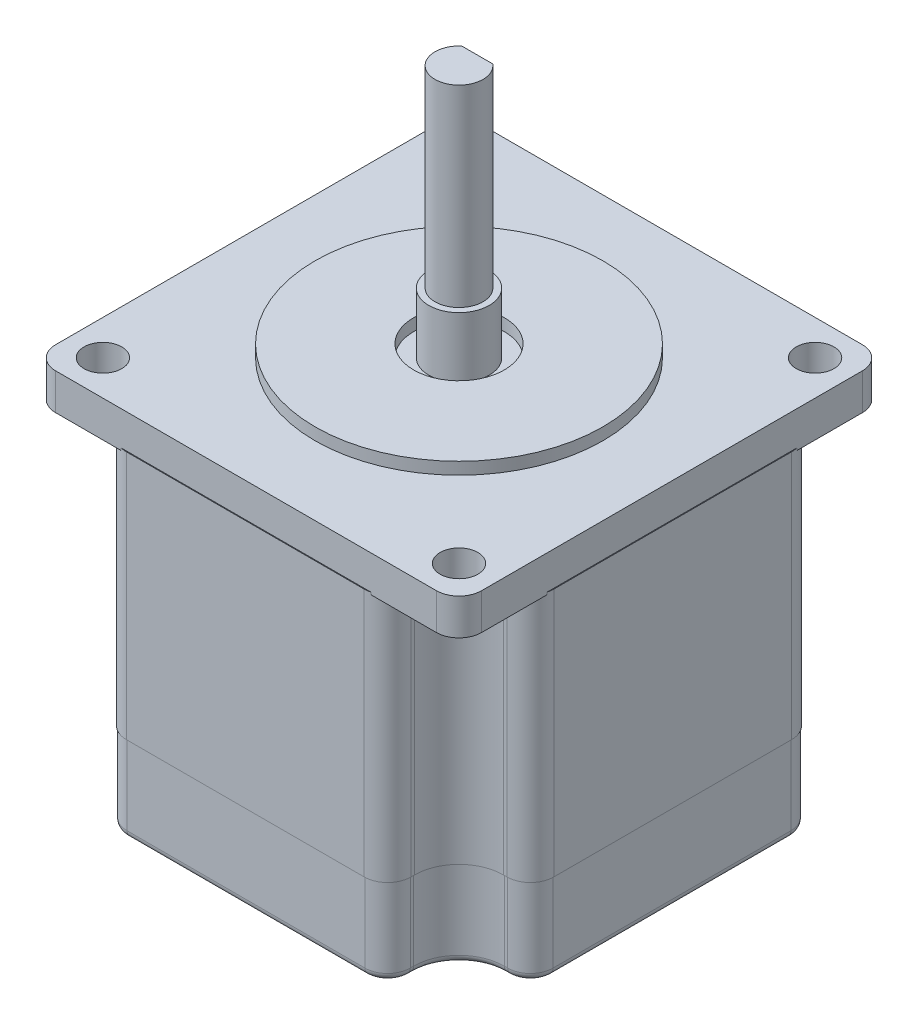
from build123d import *

# Parameters (mm, degrees)
SKETCH1_W                = 56.4
SKETCH1_H                = 56.4
BOSS_EXTRUDE1_DEPTH      = 24.5
CUT_EXTRUDE1_START       = 4.8
CUT_EXTRUDE1_DEPTH       = 59.378160784
FILLET1_R                = 3
FILLET2_R                = 1
SKETCH3_R                = 2.5
CUT_EXTRUDE2_DEPTH       = 55.8
SKETCH4_R                = 19.05
BOSS_EXTRUDE2_DEPTH      = 1.6
SKETCH5_R                = 3.175
BOSS_EXTRUDE3_DEPTH      = 33.5
CUT_EXTRUDE3_START       = -15
CUT_EXTRUDE3_DEPTH       = 15
CUT_EXTRUDE4_DEPTH       = 71.388067171
CUT_EXTRUDE4_DEPTH_BACK  = 71.388067171
FILLET3_R                = 5
CUT_EXTRUDE5_START       = -1.6
SKETCH8_R                = 6
SKETCH8_R_2              = 3.175
CUT_EXTRUDE5_DEPTH       = 1.6
BOSS_EXTRUDE4_START      = -11.5
BOSS_EXTRUDE4_DEPTH      = 33
BOSS_EXTRUDE5_DEPTH      = 6.4
BOSS_EXTRUDE5_DEPTH_BACK = 50.6
SKETCH11_R               = 4
BOSS_EXTRUDE6_START      = -1
SKETCH12_W               = 20.6
SKETCH12_H               = 11.5
BOSS_EXTRUDE6_DEPTH      = 6.4


with BuildPart() as part:
    # Sketch1 → Boss-Extrude1 (new, symmetric)
    with BuildSketch(Plane(origin=(0, 0, 0), x_dir=(1, 0, 0), z_dir=(0, 1, 0))):
        Rectangle(SKETCH1_W, SKETCH1_H)
    extrude(amount=BOSS_EXTRUDE1_DEPTH, both=True)

    # Sketch2 → Cut-Extrude1 (cut, through all)
    with BuildSketch(Plane.XZ.offset(-24.5).offset(CUT_EXTRUDE1_START)):
        with BuildLine():
            Line((-18.75, 28.2), (-18.75, 24.75))
            ThreePointArc((-18.75, 24.75), (-20.507359313, 20.507359313), (-24.75, 18.75))
            Line((-24.75, 18.75), (-28.2, 18.75))
            Line((-28.2, 18.75), (-28.2, 28.2))
            Line((-28.2, 28.2), (-18.75, 28.2))
        make_face()
        with BuildLine():
            Line((28.2, 28.2), (28.2, 18.75))
            Line((28.2, 18.75), (24.75, 18.75))
            ThreePointArc((24.75, 18.75), (20.507359313, 20.507359313), (18.75, 24.75))
            Line((18.75, 24.75), (18.75, 28.2))
            Line((18.75, 28.2), (28.2, 28.2))
        make_face()
        with BuildLine():
            Line((18.75, -28.2), (18.75, -24.75))
            ThreePointArc((18.75, -24.75), (20.507359313, -20.507359313), (24.75, -18.75))
            Line((24.75, -18.75), (28.2, -18.75))
            Line((28.2, -18.75), (28.2, -28.2))
            Line((28.2, -28.2), (18.75, -28.2))
        make_face()
        with BuildLine():
            Line((-28.2, -28.2), (-28.2, -18.75))
            Line((-28.2, -18.75), (-24.75, -18.75))
            ThreePointArc((-24.75, -18.75), (-20.507359313, -20.507359313), (-18.75, -24.75))
            Line((-18.75, -24.75), (-18.75, -28.2))
            Line((-18.75, -28.2), (-28.2, -28.2))
        make_face()
    extrude(amount=CUT_EXTRUDE1_DEPTH, mode=Mode.SUBTRACT)

    # Fillet1
    fillet1_edges = [part.edges().sort_by_distance(p)[0] for p in [
        (-28.2, -2.4, -18.75),
        (-18.75, -2.4, -28.2),
        (18.75, -2.4, -28.2),
        (28.2, -2.4, -18.75),
        (28.2, -2.4, 18.75),
        (18.75, -2.4, 28.2),
        (-18.75, -2.4, 28.2),
        (-28.2, -2.4, 18.75),
        (28.2, 22.1, 28.2),
        (-28.2, 22.1, 28.2),
        (-28.2, 22.1, -28.2),
        (28.2, 22.1, -28.2),
    ]]
    fillet(fillet1_edges, radius=FILLET1_R)

    # Fillet2
    fillet2_edges = [part.edges().sort_by_distance(p)[0] for p in [
        (-20.507359313, -24.5, -20.507359313),
        (-24.975, -24.5, -18.75),
        (20.507359313, -24.5, -20.507359313),
        (18.75, -24.5, -24.975),
        (20.507359313, -24.5, 20.507359313),
        (24.975, -24.5, 18.75),
        (-20.507359313, -24.5, 20.507359313),
        (-18.75, -24.5, 24.975),
        (-28.2, -24.5, 0),
        (-18.75, -24.5, -24.975),
        (0, -24.5, -28.2),
        (24.975, -24.5, -18.75),
        (28.2, -24.5, 0),
        (18.75, -24.5, 24.975),
        (0, -24.5, 28.2),
        (-24.975, -24.5, 18.75),
        (-17.871320344, -24.5, 27.321320344),
        (-17.871320344, -24.5, -27.321320344),
        (17.871320344, -24.5, -27.321320344),
        (27.321320344, -24.5, -17.871320344),
        (27.321320344, -24.5, 17.871320344),
        (17.871320344, -24.5, 27.321320344),
        (-27.321320344, -24.5, 17.871320344),
        (-27.321320344, -24.5, -17.871320344),
    ]]
    fillet(fillet2_edges, radius=FILLET2_R)

    # Sketch3 → Cut-Extrude2 (cut)
    with BuildSketch(Plane(origin=(0, 24.5, 0), x_dir=(1, 0, 0), z_dir=(0, 1, 0))):
        with Locations(Location((23.57, 23.57, 0), (0, 0, 270))):
            Circle(SKETCH3_R)
        with Locations(Location((-23.57, 23.57, 0), (0, 0, 90))):
            Circle(SKETCH3_R)
        with Locations(Location((23.57, -23.57, 0), (0, 0, 90))):
            Circle(SKETCH3_R)
        with Locations(Location((-23.57, -23.57, 0), (0, 0, 270))):
            Circle(SKETCH3_R)
    extrude(amount=-CUT_EXTRUDE2_DEPTH, mode=Mode.SUBTRACT)

    # Sketch4 → Boss-Extrude2 (add)
    with BuildSketch(Plane(origin=(0, 24.5, 0), x_dir=(1, 0, 0), z_dir=(0, 1, 0))):
        with Locations(Location((0, 0, 0), (0, 0, 270))):
            Circle(SKETCH4_R)
    extrude(amount=BOSS_EXTRUDE2_DEPTH)

    # Sketch5 → Boss-Extrude3 (add)
    with BuildSketch(Plane(origin=(0, 24.5, 0), x_dir=(1, 0, 0), z_dir=(0, 1, 0))):
        with Locations(Location((0, 0, 0), (0, 0, 270))):
            Circle(SKETCH5_R)
    extrude(amount=BOSS_EXTRUDE3_DEPTH)

    # Sketch6 → Cut-Extrude3 (cut)
    with BuildSketch(Plane(origin=(0, 58, 0), x_dir=(1, 0, 0), z_dir=(0, 1, 0)).offset(CUT_EXTRUDE3_START)):
        with BuildLine():
            Line((-2.049390153, 2.425), (2.049390153, 2.425))
            ThreePointArc((2.049390153, 2.425), (0, 3.175), (-2.049390153, 2.425))
        make_face()
    extrude(amount=CUT_EXTRUDE3_DEPTH, mode=Mode.SUBTRACT)

    # Sketch7 → Cut-Extrude4 (cut, two sides: drawn at the far end of the back side and taken through both)
    with BuildSketch(Plane(origin=(0, 0, 0), x_dir=(0, 0, -1), z_dir=(1, 0, 0)).offset(-CUT_EXTRUDE4_DEPTH_BACK)):
        Polygon((2.425, 43), (3.175, 41), (3.175, 43), align=None)
    extrude(amount=CUT_EXTRUDE4_DEPTH + CUT_EXTRUDE4_DEPTH_BACK, mode=Mode.SUBTRACT)

    # Fillet3
    fillet3_edges = [part.edges().sort_by_distance(p)[0] for p in [
        (0, 43, -2.425),
    ]]
    fillet(fillet3_edges, radius=FILLET3_R)

    # Sketch8 → Cut-Extrude5 (cut)
    with BuildSketch(Plane(origin=(0, 26.1, 0), x_dir=(1, 0, 0), z_dir=(0, 1, 0)).offset(CUT_EXTRUDE5_START)):
        with Locations(Location((0, 0, 0), (0, 0, 270))):
            Circle(SKETCH8_R)
        with Locations(Location((0, 0, 0), (0, 0, 59.774237817))):
            Circle(SKETCH8_R_2, mode=Mode.SUBTRACT)
    extrude(amount=CUT_EXTRUDE5_DEPTH, mode=Mode.SUBTRACT)

    # Sketch11 → Boss-Extrude5 (add, two sides: drawn at the far end of the back side and taken through both)
    with BuildSketch(Plane(origin=(0, 26.1, 0), x_dir=(1, 0, 0), z_dir=(0, 1, 0)).offset(-BOSS_EXTRUDE5_DEPTH_BACK)):
        with Locations(Location((0, 0, 0), (0, 0, 270))):
            Circle(SKETCH11_R)
    extrude(amount=BOSS_EXTRUDE5_DEPTH + BOSS_EXTRUDE5_DEPTH_BACK)



with BuildPart() as body_2:
    # Sketch10 → Boss-Extrude4 (new body)
    with BuildSketch(Plane.XZ.offset(24.5).offset(BOSS_EXTRUDE4_START)):
        with BuildLine():
            Line((25.2, 18.85), (24.75, 18.85))
            ThreePointArc((24.75, 18.85), (20.578069991, 20.578069991), (18.85, 24.75))
            Line((18.85, 24.75), (18.85, 25.2))
            ThreePointArc((18.85, 25.2), (17.942031022, 27.392031022), (15.75, 28.3))
            Line((15.75, 28.3), (-15.75, 28.3))
            ThreePointArc((-15.75, 28.3), (-17.942031022, 27.392031022), (-18.85, 25.2))
            Line((-18.85, 25.2), (-18.85, 24.75))
            ThreePointArc((-18.85, 24.75), (-20.578069991, 20.578069991), (-24.75, 18.85))
            Line((-24.75, 18.85), (-25.2, 18.85))
            ThreePointArc((-25.2, 18.85), (-27.392031022, 17.942031022), (-28.3, 15.75))
            Line((-28.3, 15.75), (-28.3, -15.75))
            ThreePointArc((-28.3, -15.75), (-27.392031022, -17.942031022), (-25.2, -18.85))
            Line((-25.2, -18.85), (-24.75, -18.85))
            ThreePointArc((-24.75, -18.85), (-20.578069991, -20.578069991), (-18.85, -24.75))
            Line((-18.85, -24.75), (-18.85, -25.2))
            ThreePointArc((-18.85, -25.2), (-17.942031022, -27.392031022), (-15.75, -28.3))
            Line((-15.75, -28.3), (15.75, -28.3))
            ThreePointArc((15.75, -28.3), (17.942031022, -27.392031022), (18.85, -25.2))
            Line((18.85, -25.2), (18.85, -24.75))
            ThreePointArc((18.85, -24.75), (20.578069991, -20.578069991), (24.75, -18.85))
            Line((24.75, -18.85), (25.2, -18.85))
            ThreePointArc((25.2, -18.85), (27.392031022, -17.942031022), (28.3, -15.75))
            Line((28.3, -15.75), (28.3, 15.75))
            ThreePointArc((28.3, 15.75), (27.392031022, 17.942031022), (25.2, 18.85))
        make_face()
        with BuildLine():
            Line((28.2, -15.75), (28.2, 15.75))
            ThreePointArc((28.2, 15.75), (27.321320344, 17.871320344), (25.2, 18.75))
            Line((25.2, 18.75), (24.75, 18.75))
            ThreePointArc((24.75, 18.75), (20.507359313, 20.507359313), (18.75, 24.75))
            Line((18.75, 24.75), (18.75, 25.2))
            ThreePointArc((18.75, 25.2), (17.871320344, 27.321320344), (15.75, 28.2))
            Line((15.75, 28.2), (-15.75, 28.2))
            ThreePointArc((-15.75, 28.2), (-17.871320344, 27.321320344), (-18.75, 25.2))
            Line((-18.75, 25.2), (-18.75, 24.75))
            ThreePointArc((-18.75, 24.75), (-20.507359313, 20.507359313), (-24.75, 18.75))
            Line((-24.75, 18.75), (-25.2, 18.75))
            ThreePointArc((-25.2, 18.75), (-27.321320344, 17.871320344), (-28.2, 15.75))
            Line((-28.2, 15.75), (-28.2, -15.75))
            ThreePointArc((-28.2, -15.75), (-27.321320344, -17.871320344), (-25.2, -18.75))
            Line((-25.2, -18.75), (-24.75, -18.75))
            ThreePointArc((-24.75, -18.75), (-20.507359313, -20.507359313), (-18.75, -24.75))
            Line((-18.75, -24.75), (-18.75, -25.2))
            ThreePointArc((-18.75, -25.2), (-17.871320344, -27.321320344), (-15.75, -28.2))
            Line((-15.75, -28.2), (15.75, -28.2))
            ThreePointArc((15.75, -28.2), (17.871320344, -27.321320344), (18.75, -25.2))
            Line((18.75, -25.2), (18.75, -24.75))
            ThreePointArc((18.75, -24.75), (20.507359313, -20.507359313), (24.75, -18.75))
            Line((24.75, -18.75), (25.2, -18.75))
            ThreePointArc((25.2, -18.75), (27.321320344, -17.871320344), (28.2, -15.75))
        make_face(mode=Mode.SUBTRACT)
    extrude(amount=-BOSS_EXTRUDE4_DEPTH)


with BuildPart() as part_1:
    add(part.part)

    add(body_2.part)  # Boss-Extrude6 merges body 2
    # Sketch12 → Boss-Extrude6 (add)
    with BuildSketch(Plane(origin=(0, 0, -28.2), x_dir=(-1, 0, 0), z_dir=(0, 0, -1)).offset(BOSS_EXTRUDE6_START)):
        with Locations((0, -18.75)):
            Rectangle(SKETCH12_W, SKETCH12_H)
    extrude(amount=BOSS_EXTRUDE6_DEPTH)


solid = part_1.part
